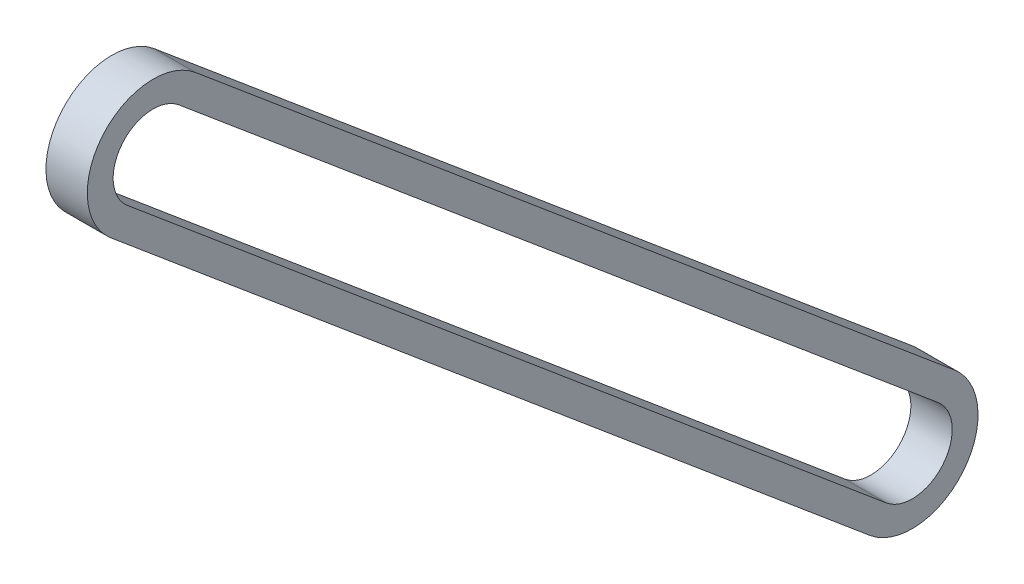
from build123d import *

# Parameters (mm, degrees)
BOSS_EXTRUDE1_DEPTH = 1.6


with BuildPart() as part:
    # Sketch1 → Boss-Extrude1 (new body)
    with BuildSketch(Plane.ZY.offset(-5.18823967)):
        with BuildLine():
            ThreePointArc((10.414466289, -10.474403582), (10.727931837, -6.88180851), (7.135336765, -6.568342962))
            Line((7.135336765, -6.568342962), (-22.254454563, -31.241009834))
            ThreePointArc((-22.254454563, -31.241009834), (-22.567920111, -34.833604906), (-18.975325039, -35.147070454))
            Line((-18.975325039, -35.147070454), (10.414466289, -10.474403582))
        make_face()
        with BuildLine():
            ThreePointArc((10.324901527, -8.521373272), (10.179755112, -9.176267465), (9.771499716, -9.708509343))
            Line((9.771499716, -9.708509343), (-19.618291612, -34.381176215))
            ThreePointArc((-19.618291612, -34.381176215), (-21.802025871, -34.190638333), (-21.611487989, -32.006904073))
            Line((-21.611487989, -32.006904073), (7.778303338, -7.334237201))
            ThreePointArc((7.778303338, -7.334237201), (9.42979572, -7.116519687), (10.324901527, -8.521373272))
        make_face(mode=Mode.SUBTRACT)
    extrude(amount=BOSS_EXTRUDE1_DEPTH)


solid = part.part
